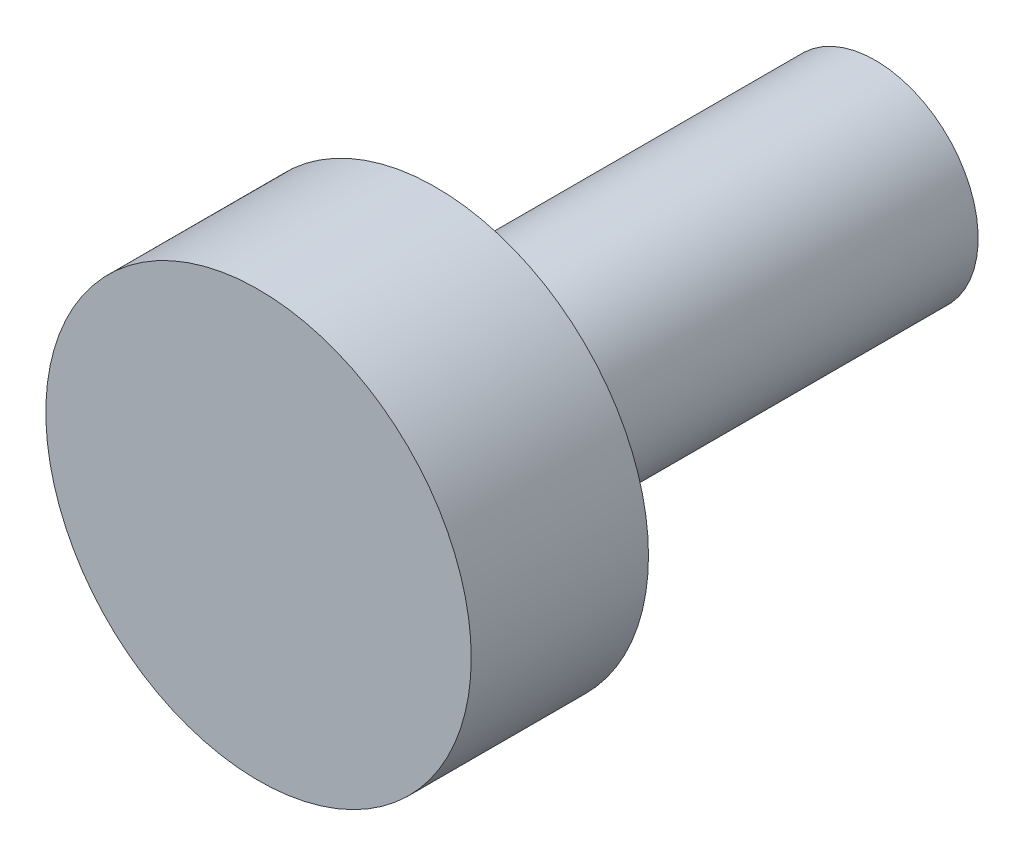
from build123d import *

# Parameters (mm, degrees)
SKETCH1_R           = 3
BOSS_EXTRUDE1_DEPTH = 2.5
BOSS_EXTRUDE2_START = -6.2
SKETCH2_R           = 1.45
BOSS_EXTRUDE2_DEPTH = 6.2


with BuildPart() as part:
    # Sketch1 → Boss-Extrude1 (new body)
    with BuildSketch(Plane.XY):
        Circle(SKETCH1_R)
    extrude(amount=BOSS_EXTRUDE1_DEPTH)

    # Sketch2 → Boss-Extrude2 (add)
    with BuildSketch(Plane.XY.offset(BOSS_EXTRUDE2_START)):
        with Locations(Location((0, 0, 0), (0, 0, 180))):
            Circle(SKETCH2_R)
    extrude(amount=BOSS_EXTRUDE2_DEPTH)


solid = part.part
